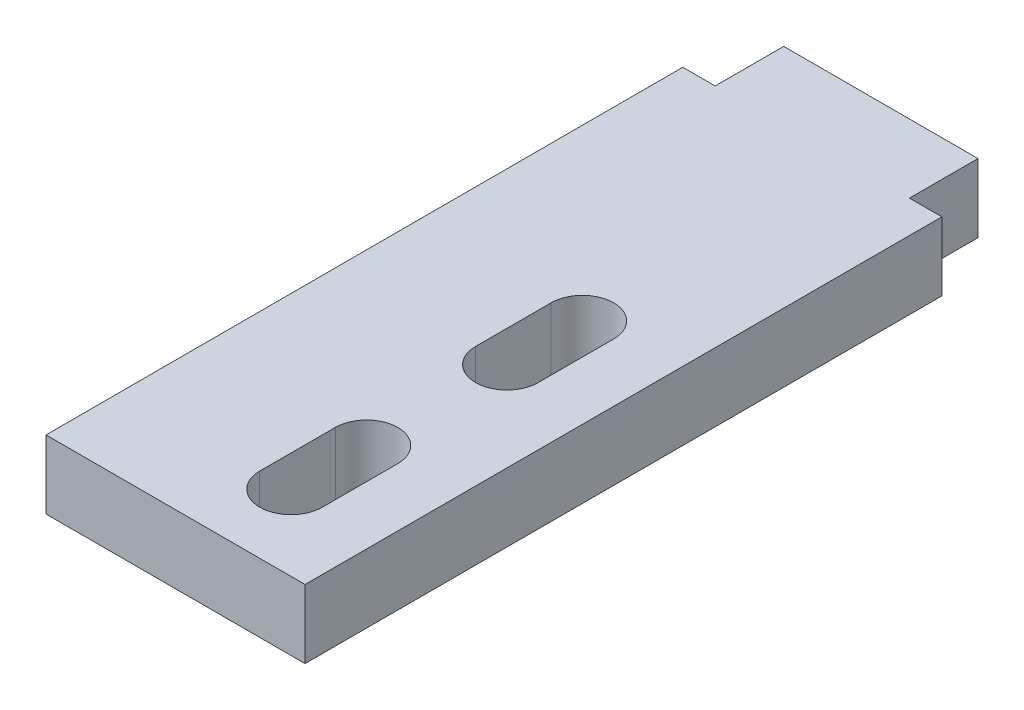
from build123d import *

# Parameters (mm, degrees)
BOSS_EXTRUDE1_DEPTH = 3.175


with BuildPart() as part:
    # Sketch1 → Boss-Extrude1 (new body)
    with BuildSketch(Plane(origin=(0, 0, 0), x_dir=(1, 0, 0), z_dir=(0, 1, 0))):
        Polygon((-32.35, -10.25), (-20.35, -10.25), (-20.35, 19.25), (-21.85, 19.25), (-21.85, 22.425), (-30.85, 22.425), (-30.85, 19.25), (-32.35, 19.25), align=None)
        with BuildLine():
            Line((-25.95, -6.75), (-25.95, -3.25))
            ThreePointArc((-25.95, -3.25), (-24.5, -1.8), (-23.05, -3.25))
            Line((-23.05, -3.25), (-23.05, -6.75))
            ThreePointArc((-23.05, -6.75), (-24.5, -8.2), (-25.95, -6.75))
        make_face(mode=Mode.SUBTRACT)
        with BuildLine():
            Line((-25.95, 3.25), (-25.95, 6.75))
            ThreePointArc((-25.95, 6.75), (-24.5, 8.2), (-23.05, 6.75))
            Line((-23.05, 6.75), (-23.05, 3.25))
            ThreePointArc((-23.05, 3.25), (-24.5, 1.8), (-25.95, 3.25))
        make_face(mode=Mode.SUBTRACT)
    extrude(amount=BOSS_EXTRUDE1_DEPTH)


solid = part.part
